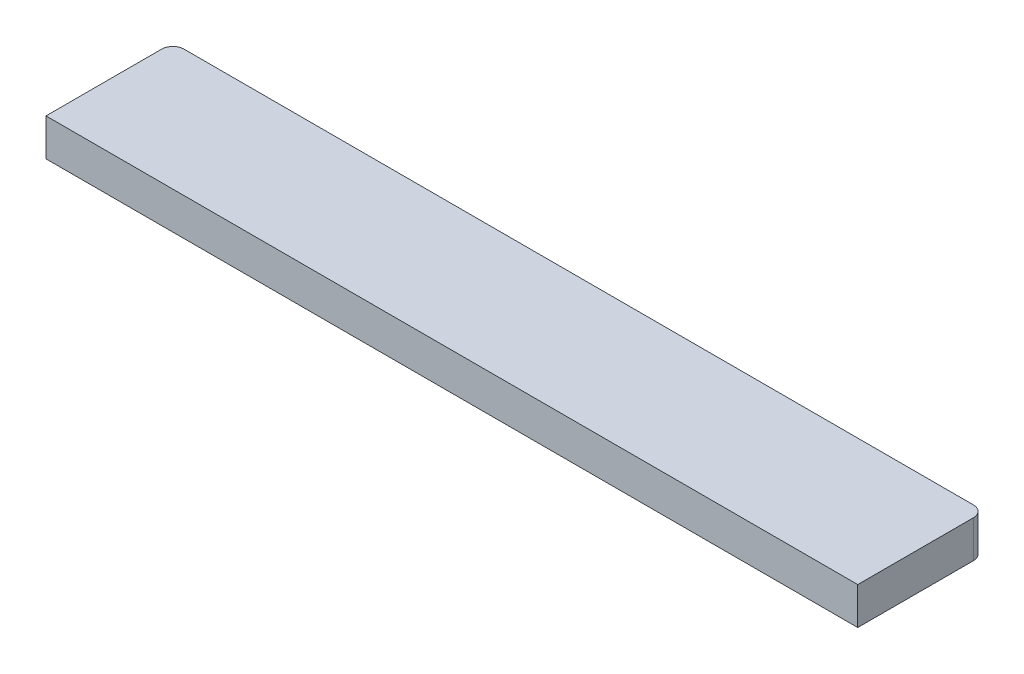
from build123d import *

# Parameters (mm, degrees)
SKETCH_1_W      = 218
SKETCH_1_H      = 34.06
EXTRUDE_1_DEPTH = 10
FILLET_1_R      = 3


with BuildPart() as part:
    # 草图1 → 凸台-拉伸1 (new body)
    with BuildSketch(Plane(origin=(0, 0, 0), x_dir=(1, 0, 0), z_dir=(0, 1, 0))):
        with Locations((109, -17.03)):
            Rectangle(SKETCH_1_W, SKETCH_1_H)
    extrude(amount=EXTRUDE_1_DEPTH)

    # 圆角1
    fillet_1_edges = [part.edges().sort_by_distance(p)[0] for p in [
        (0, 5, 0),
        (218, 5, 0),
    ]]
    fillet(fillet_1_edges, radius=FILLET_1_R)


solid = part.part
